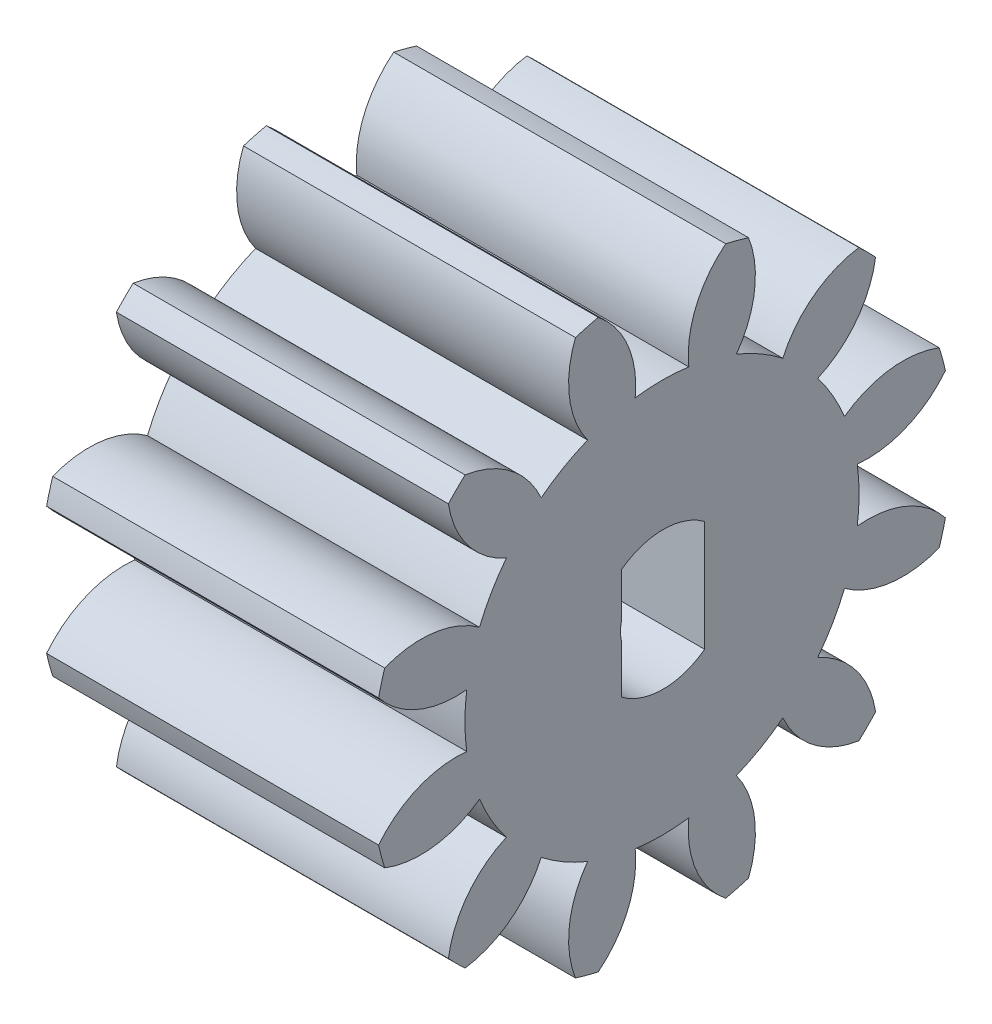
from build123d import *

# Parameters (mm, degrees)
BASPROSKE_W        = 12
BASPROSKE_H        = 10.5
TOOTHCUT_DEPTH     = 20.091883092
TEETHCUTS_COUNT    = 12
TEETHCUTS_ANGLE    = 330
BORSKE_R           = 1.5
BORE_DEPTH         = 50.0000508
CUT_EXTRUDE1_DEPTH = 15


with BuildPart() as part:
    # BasProSke → Base-Revolve (revolve)
    with BuildSketch(Plane(origin=(0, 0, 0), x_dir=(1, 0, 0), z_dir=(0, 1, 0)), mode=Mode.PRIVATE) as base_revolve_sk:
        with Locations((6, 5.25)):
            Rectangle(BASPROSKE_W, BASPROSKE_H)
    revolve(base_revolve_sk.sketch.rotate(Axis((-10, 0, 0), (1, 0, 0)), 180), axis=Axis((-10, 0, 0), (1, 0, 0)))

    # TooCutSke → ToothCut (cut, through all)
    with BuildSketch(Plane(origin=(0, 0, 0), x_dir=(0, 0, -1), z_dir=(1, 0, 0))):
        with BuildLine():
            ThreePointArc((0.968931207, 7.05780053), (0, 7.124), (-0.968931207, 7.05780053))
            ThreePointArc((-0.968931207, 7.05780053), (-1.23511503, 8.836576748), (-2.328591557, 10.264585063))
            ThreePointArc((-2.328591557, 10.264585063), (0, 10.5254), (2.328591557, 10.264585063))
            ThreePointArc((2.328591557, 10.264585063), (1.23511503, 8.836576748), (0.968931207, 7.05780053))
        make_face()
    toothcut = extrude(amount=TOOTHCUT_DEPTH, mode=Mode.SUBTRACT)

    # TeethCuts: ToothCut ×12 about axis
    teethcuts_axis = Axis((-10, 0, 0), (1, 0, 0))
    for i in range(1, TEETHCUTS_COUNT):
        add(toothcut.rotate(teethcuts_axis, i * TEETHCUTS_ANGLE / (TEETHCUTS_COUNT - 1)), mode=Mode.SUBTRACT)

    # BorSke → Bore (cut, symmetric)
    with BuildSketch(Plane(origin=(0, 0, 0), x_dir=(0, 0, -1), z_dir=(1, 0, 0))):
        with Locations(Location((0, 0, 0), (0, 0, 180))):
            Circle(BORSKE_R)
    extrude(amount=BORE_DEPTH, both=True, mode=Mode.SUBTRACT)

    # Sketch1 → Cut-Extrude1 (cut)
    with BuildSketch(Plane(origin=(12, 0, 0), x_dir=(0, 0, -1), z_dir=(1, 0, 0))):
        with BuildLine():
            Line((1.540634556, -2.067724259), (1.540634556, 1.932275741))
            ThreePointArc((1.540634556, 1.932275741), (0.040634556, 2.432275741), (-1.459365444, 1.932275741))
            Line((-1.459365444, 1.932275741), (-1.459365444, -2.067724259))
            ThreePointArc((-1.459365444, -2.067724259), (0.040634556, -2.567724259), (1.540634556, -2.067724259))
        make_face()
    extrude(amount=-CUT_EXTRUDE1_DEPTH, mode=Mode.SUBTRACT)


solid = part.part
